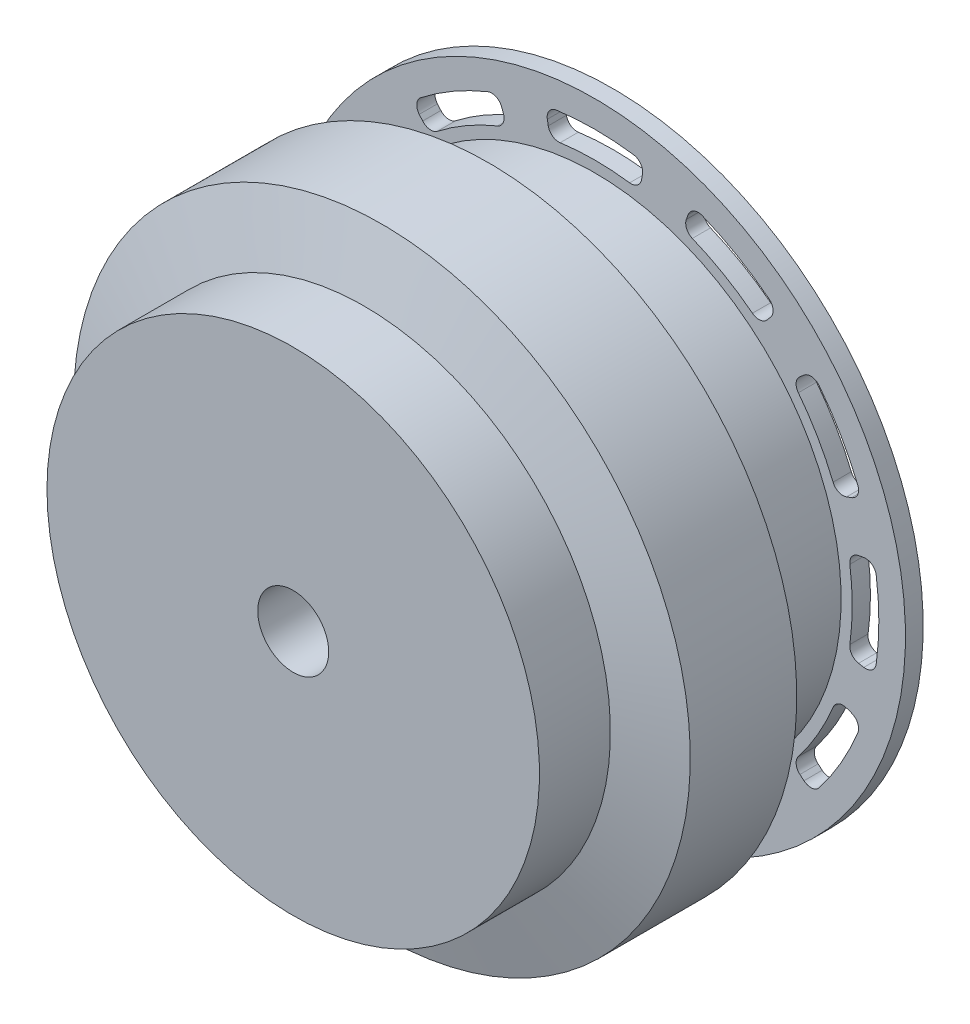
from build123d import *

# Parameters (mm, degrees)
ESQUISSE3_R             = 3
BOSS_EXTRU_1_DEPTH      = 3.4
CONG_1_R                = 1
ENL_V_MAT_EXTRU_1_DEPTH = 5
ESQUISSE5_R             = 2
ENL_V_MAT_EXTRU_2_DEPTH = 15


with BuildPart() as part:
    # Esquisse2 → Révolution1 (revolve)
    with BuildSketch(Plane(origin=(0, 0, 0), x_dir=(1, 0, 0), z_dir=(0, 1, 0))):
        with BuildLine():
            add(Edge.make_bspline(
                [(-17.5, 1), (1.03345542, 1.332860969), (-9.767341607, -1.55535011), (0, -1.612468306)],
                knots=[0, 0, 0, 0, 1, 1, 1, 1], degree=3))
            Line((-17.5, 1), (-17.5, 0))
            Line((-17.5, 0), (-13.875, 0))
            Line((-13.875, 0), (-13.875, -5))
            Line((-13.875, -5), (-17.375, -6))
            Line((-17.375, -6), (-17.375, -12))
            Line((-17.375, -12), (-13.875, -13))
            Line((-13.875, -13), (-13.875, -17))
            Line((-13.875, -17), (0, -17))
            Line((0, -17), (0, -1.612468306))
        make_face()
    revolve(axis=Axis((0, 0, -11.451767974), (0, 0, 1)))

    # Esquisse4 → Enlèv. mat.-Extru.1 (cut, symmetric)
    with BuildSketch(Plane.XY):
        with BuildLine():
            Line((-2.680605336, 15.153031216), (-2.628305574, 14.857389064))
            ThreePointArc((-2.628305574, 14.857389064), (-2.391053327, 14.477154775), (-1.956519702, 14.367394707))
            ThreePointArc((-1.956519702, 14.367394707), (0, 14.5), (1.956519702, 14.367394707))
            ThreePointArc((1.956519702, 14.367394707), (2.391053327, 14.477154775), (2.628305574, 14.857389064))
            Line((2.628305574, 14.857389064), (2.680605336, 15.153031216))
            ThreePointArc((2.680605336, 15.153031216), (2.57466863, 15.610936146), (2.171198857, 15.851999733))
            ThreePointArc((2.171198857, 15.851999733), (0, 16), (-2.171198857, 15.851999733))
            ThreePointArc((-2.171198857, 15.851999733), (-2.57466863, 15.610936146), (-2.680605336, 15.153031216))
        make_face()
        with BuildLine():
            Line((5.255043289, 14.463212645), (5.152515136, 14.181029151))
            ThreePointArc((5.152515136, 14.181029151), (5.167864465, 13.733110473), (5.489301588, 13.420788653))
            ThreePointArc((5.489301588, 13.420788653), (7.25, 12.557368355), (8.878093118, 11.464268951))
            ThreePointArc((8.878093118, 11.464268951), (9.30929031, 11.342057146), (9.704873928, 11.552723577))
            Line((9.704873928, 11.552723577), (9.897987927, 11.782607309))
            ThreePointArc((9.897987927, 11.782607309), (10.035196513, 12.232132964), (9.806313233, 12.642635041))
            ThreePointArc((9.806313233, 12.642635041), (8, 13.856406461), (6.045686499, 14.813833898))
            ThreePointArc((6.045686499, 14.813833898), (5.575739633, 14.806801594), (5.255043289, 14.463212645))
        make_face()
        with BuildLine():
            Line((11.782607309, 9.897987927), (11.552723577, 9.704873928))
            ThreePointArc((11.552723577, 9.704873928), (11.342057146, 9.30929031), (11.464268951, 8.878093118))
            ThreePointArc((11.464268951, 8.878093118), (12.557368355, 7.25), (13.420788653, 5.489301588))
            ThreePointArc((13.420788653, 5.489301588), (13.733110473, 5.167864465), (14.181029151, 5.152515136))
            Line((14.181029151, 5.152515136), (14.463212645, 5.255043289))
            ThreePointArc((14.463212645, 5.255043289), (14.806801594, 5.575739633), (14.813833898, 6.045686499))
            ThreePointArc((14.813833898, 6.045686499), (13.856406461, 8), (12.642635041, 9.806313233))
            ThreePointArc((12.642635041, 9.806313233), (12.232132964, 10.035196513), (11.782607309, 9.897987927))
        make_face()
        with BuildLine():
            Line((15.153031216, 2.680605336), (14.857389064, 2.628305574))
            ThreePointArc((14.857389064, 2.628305574), (14.477154775, 2.391053327), (14.367394707, 1.956519702))
            ThreePointArc((14.367394707, 1.956519702), (14.5, 0), (14.367394707, -1.956519702))
            ThreePointArc((14.367394707, -1.956519702), (14.477154775, -2.391053327), (14.857389064, -2.628305574))
            Line((14.857389064, -2.628305574), (15.153031216, -2.680605336))
            ThreePointArc((15.153031216, -2.680605336), (15.610936146, -2.57466863), (15.851999733, -2.171198857))
            ThreePointArc((15.851999733, -2.171198857), (16, 0), (15.851999733, 2.171198857))
            ThreePointArc((15.851999733, 2.171198857), (15.610936146, 2.57466863), (15.153031216, 2.680605336))
        make_face()
        with BuildLine():
            Line((14.463212645, -5.255043289), (14.181029151, -5.152515136))
            ThreePointArc((14.181029151, -5.152515136), (13.733110473, -5.167864465), (13.420788653, -5.489301588))
            ThreePointArc((13.420788653, -5.489301588), (12.557368355, -7.25), (11.464268951, -8.878093118))
            ThreePointArc((11.464268951, -8.878093118), (11.342057146, -9.30929031), (11.552723577, -9.704873928))
            Line((11.552723577, -9.704873928), (11.782607309, -9.897987927))
            ThreePointArc((11.782607309, -9.897987927), (12.232132964, -10.035196513), (12.642635041, -9.806313233))
            ThreePointArc((12.642635041, -9.806313233), (13.856406461, -8), (14.813833898, -6.045686499))
            ThreePointArc((14.813833898, -6.045686499), (14.806801594, -5.575739633), (14.463212645, -5.255043289))
        make_face()
        with BuildLine():
            Line((9.897987927, -11.782607309), (9.704873928, -11.552723577))
            ThreePointArc((9.704873928, -11.552723577), (9.30929031, -11.342057146), (8.878093118, -11.464268951))
            ThreePointArc((8.878093118, -11.464268951), (7.25, -12.557368355), (5.489301588, -13.420788653))
            ThreePointArc((5.489301588, -13.420788653), (5.167864465, -13.733110473), (5.152515136, -14.181029151))
            Line((5.152515136, -14.181029151), (5.255043289, -14.463212645))
            ThreePointArc((5.255043289, -14.463212645), (5.575739633, -14.806801594), (6.045686499, -14.813833898))
            ThreePointArc((6.045686499, -14.813833898), (8, -13.856406461), (9.806313233, -12.642635041))
            ThreePointArc((9.806313233, -12.642635041), (10.035196513, -12.232132964), (9.897987927, -11.782607309))
        make_face()
        with BuildLine():
            Line((2.680605336, -15.153031216), (2.628305574, -14.857389064))
            ThreePointArc((2.628305574, -14.857389064), (2.391053327, -14.477154775), (1.956519702, -14.367394707))
            ThreePointArc((1.956519702, -14.367394707), (0, -14.5), (-1.956519702, -14.367394707))
            ThreePointArc((-1.956519702, -14.367394707), (-2.391053327, -14.477154775), (-2.628305574, -14.857389064))
            Line((-2.628305574, -14.857389064), (-2.680605336, -15.153031216))
            ThreePointArc((-2.680605336, -15.153031216), (-2.57466863, -15.610936146), (-2.171198857, -15.851999733))
            ThreePointArc((-2.171198857, -15.851999733), (0, -16), (2.171198857, -15.851999733))
            ThreePointArc((2.171198857, -15.851999733), (2.57466863, -15.610936146), (2.680605336, -15.153031216))
        make_face()
        with BuildLine():
            Line((-5.255043289, -14.463212645), (-5.152515136, -14.181029151))
            ThreePointArc((-5.152515136, -14.181029151), (-5.167864465, -13.733110473), (-5.489301588, -13.420788653))
            ThreePointArc((-5.489301588, -13.420788653), (-7.25, -12.557368355), (-8.878093118, -11.464268951))
            ThreePointArc((-8.878093118, -11.464268951), (-9.30929031, -11.342057146), (-9.704873928, -11.552723577))
            Line((-9.704873928, -11.552723577), (-9.897987927, -11.782607309))
            ThreePointArc((-9.897987927, -11.782607309), (-10.035196513, -12.232132964), (-9.806313233, -12.642635041))
            ThreePointArc((-9.806313233, -12.642635041), (-8, -13.856406461), (-6.045686499, -14.813833898))
            ThreePointArc((-6.045686499, -14.813833898), (-5.575739633, -14.806801594), (-5.255043289, -14.463212645))
        make_face()
        with BuildLine():
            Line((-11.782607309, -9.897987927), (-11.552723577, -9.704873928))
            ThreePointArc((-11.552723577, -9.704873928), (-11.342057146, -9.30929031), (-11.464268951, -8.878093118))
            ThreePointArc((-11.464268951, -8.878093118), (-12.557368355, -7.25), (-13.420788653, -5.489301588))
            ThreePointArc((-13.420788653, -5.489301588), (-13.733110473, -5.167864465), (-14.181029151, -5.152515136))
            Line((-14.181029151, -5.152515136), (-14.463212645, -5.255043289))
            ThreePointArc((-14.463212645, -5.255043289), (-14.806801594, -5.575739633), (-14.813833898, -6.045686499))
            ThreePointArc((-14.813833898, -6.045686499), (-13.856406461, -8), (-12.642635041, -9.806313233))
            ThreePointArc((-12.642635041, -9.806313233), (-12.232132964, -10.035196513), (-11.782607309, -9.897987927))
        make_face()
        with BuildLine():
            Line((-15.153031216, -2.680605336), (-14.857389064, -2.628305574))
            ThreePointArc((-14.857389064, -2.628305574), (-14.477154775, -2.391053327), (-14.367394707, -1.956519702))
            ThreePointArc((-14.367394707, -1.956519702), (-14.5, 0), (-14.367394707, 1.956519702))
            ThreePointArc((-14.367394707, 1.956519702), (-14.477154775, 2.391053327), (-14.857389064, 2.628305574))
            Line((-14.857389064, 2.628305574), (-15.153031216, 2.680605336))
            ThreePointArc((-15.153031216, 2.680605336), (-15.610936146, 2.57466863), (-15.851999733, 2.171198857))
            ThreePointArc((-15.851999733, 2.171198857), (-16, 0), (-15.851999733, -2.171198857))
            ThreePointArc((-15.851999733, -2.171198857), (-15.610936146, -2.57466863), (-15.153031216, -2.680605336))
        make_face()
        with BuildLine():
            Line((-14.463212645, 5.255043289), (-14.181029151, 5.152515136))
            ThreePointArc((-14.181029151, 5.152515136), (-13.733110473, 5.167864465), (-13.420788653, 5.489301588))
            ThreePointArc((-13.420788653, 5.489301588), (-12.557368355, 7.25), (-11.464268951, 8.878093118))
            ThreePointArc((-11.464268951, 8.878093118), (-11.342057146, 9.30929031), (-11.552723577, 9.704873928))
            Line((-11.552723577, 9.704873928), (-11.782607309, 9.897987927))
            ThreePointArc((-11.782607309, 9.897987927), (-12.232132964, 10.035196513), (-12.642635041, 9.806313233))
            ThreePointArc((-12.642635041, 9.806313233), (-13.856406461, 8), (-14.813833898, 6.045686499))
            ThreePointArc((-14.813833898, 6.045686499), (-14.806801594, 5.575739633), (-14.463212645, 5.255043289))
        make_face()
        with BuildLine():
            Line((-9.897987927, 11.782607309), (-9.704873928, 11.552723577))
            ThreePointArc((-9.704873928, 11.552723577), (-9.30929031, 11.342057146), (-8.878093118, 11.464268951))
            ThreePointArc((-8.878093118, 11.464268951), (-7.25, 12.557368355), (-5.489301588, 13.420788653))
            ThreePointArc((-5.489301588, 13.420788653), (-5.167864465, 13.733110473), (-5.152515136, 14.181029151))
            Line((-5.152515136, 14.181029151), (-5.255043289, 14.463212645))
            ThreePointArc((-5.255043289, 14.463212645), (-5.575739633, 14.806801594), (-6.045686499, 14.813833898))
            ThreePointArc((-6.045686499, 14.813833898), (-8, 13.856406461), (-9.806313233, 12.642635041))
            ThreePointArc((-9.806313233, 12.642635041), (-10.035196513, 12.232132964), (-9.897987927, 11.782607309))
        make_face()
    extrude(amount=ENL_V_MAT_EXTRU_1_DEPTH, both=True, mode=Mode.SUBTRACT)


with BuildPart() as body_2:
    # Esquisse3 → Boss.-Extru.1 (new body)
    with BuildSketch(Plane.XY):
        Circle(ESQUISSE3_R)
    extrude(amount=BOSS_EXTRU_1_DEPTH)

    # Congé1
    cong_1_edges = [body_2.edges().sort_by_distance(p)[0] for p in [
        (-3, 0, 0),
    ]]
    fillet(cong_1_edges, radius=CONG_1_R)


with BuildPart() as enl_v_mat_extru_2_tool:
    # Esquisse5 → Enlèv. mat.-Extru.2 (new body)
    with BuildSketch(Plane.XY.offset(17)):
        Circle(ESQUISSE5_R)
    extrude(amount=-ENL_V_MAT_EXTRU_2_DEPTH)


with BuildPart() as part_1:
    add(part.part)

    # Enlèv. mat.-Extru.2: cut by enl_v_mat_extru_2_tool
    add(enl_v_mat_extru_2_tool.part, mode=Mode.SUBTRACT)


with BuildPart() as body_2_1:
    add(body_2.part)

    # Enlèv. mat.-Extru.2: cut by enl_v_mat_extru_2_tool
    add(enl_v_mat_extru_2_tool.part, mode=Mode.SUBTRACT)


solid = Compound([part_1.part, body_2_1.part])
